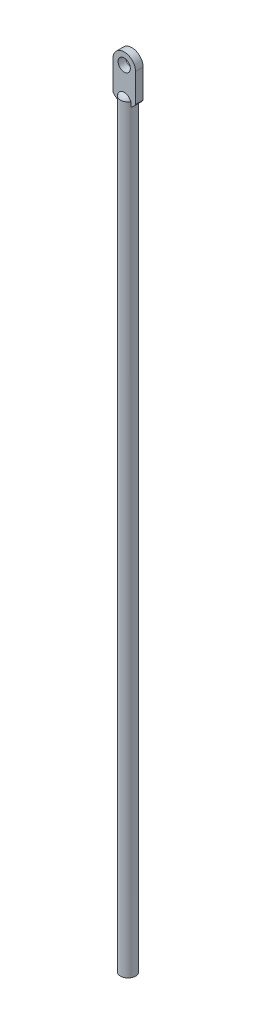
from build123d import *

# Parameters (mm, degrees)
CLEVIS_START = -4e-06
SKETCH6_R    = 4.05
CLEVIS_DEPTH = 5.00001


with BuildPart() as part:
    # Sketch5 → Body (revolve)
    with BuildSketch(Plane.XY):
        with BuildLine():
            Line((5, 496.16336506), (5, -5))
            Line((5, -5), (0, -5))
            Line((0, -5), (0, 500))
            ThreePointArc((0, 500), (3.151181035, 498.930318177), (5, 496.16336506))
        make_face()
    revolve(axis=Axis((0, -5, 0), (0, 1, 0)))

    # Sketch6 → Clevis (add)
    with BuildSketch(Plane.XY.offset(-2.5).offset(CLEVIS_START)):
        with BuildLine():
            Line((-7.5, 515), (-7.5, 496.16336506))
            ThreePointArc((-7.5, 496.16336506), (0, 491.912847956), (7.5, 496.16336506))
            Line((7.5, 496.16336506), (7.5, 515))
            ThreePointArc((7.5, 515), (0, 522.5), (-7.5, 515))
        make_face()
        with Locations((0, 515)):
            Circle(SKETCH6_R, mode=Mode.SUBTRACT)
    extrude(amount=CLEVIS_DEPTH)


solid = part.part
